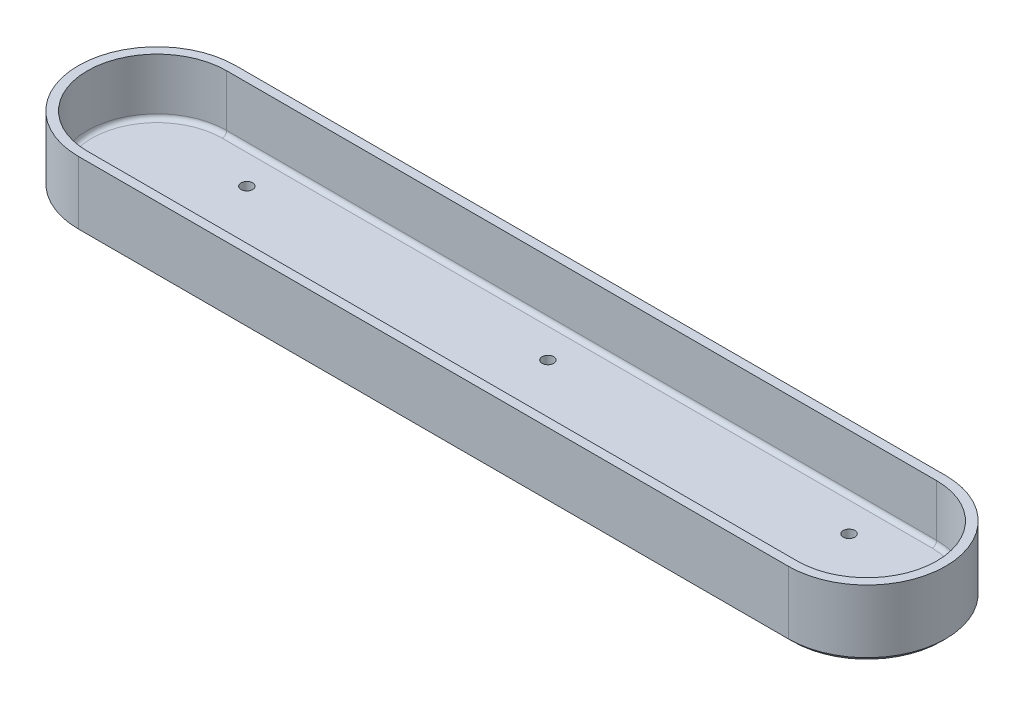
from build123d import *

# Parameters (mm, degrees)
MAINBLOCK_DEPTH     = 3.175
BOSS_EXTRUDE1_DEPTH = 19.05
SKETCH3_R           = 1.651
MOUNT_HOLES_DEPTH   = 127.00230613
FILLET1_R           = 1.27
CHAMFER1_SIZE       = 1.27


with BuildPart() as part:
    # Sketch1 → MainBlock (new body)
    with BuildSketch(Plane(origin=(0, 0, 0), x_dir=(1, 0, 0), z_dir=(0, 1, 0))):
        with BuildLine():
            Line((-100.33, 19.685), (100.33, 19.685))
            ThreePointArc((100.33, 19.685), (120.015, 0), (100.33, -19.685))
            Line((100.33, -19.685), (-100.33, -19.685))
            ThreePointArc((-100.33, -19.685), (-120.015, 0), (-100.33, 19.685))
        make_face()
    extrude(amount=MAINBLOCK_DEPTH)

    # Sketch2 → Boss-Extrude1 (add)
    with BuildSketch(Plane.XZ):
        with BuildLine():
            Line((-100.33, 22.225), (100.33, 22.225))
            ThreePointArc((100.33, 22.225), (122.555, 0), (100.33, -22.225))
            Line((100.33, -22.225), (-100.33, -22.225))
            ThreePointArc((-100.33, -22.225), (-122.555, 0), (-100.33, 22.225))
        make_face()
        with BuildLine():
            Line((100.33, 19.685), (-100.33, 19.685))
            ThreePointArc((-100.33, 19.685), (-120.015, 0), (-100.33, -19.685))
            Line((-100.33, -19.685), (100.33, -19.685))
            ThreePointArc((100.33, -19.685), (120.015, 0), (100.33, 19.685))
        make_face(mode=Mode.SUBTRACT)
    extrude(amount=-BOSS_EXTRUDE1_DEPTH)

    # Sketch3 → Mount-Holes (cut, through all)
    with BuildSketch(Plane.XZ):
        with Locations(Location((0, 10.16, 0), (0, 0, 270))):
            Circle(SKETCH3_R)
        with Locations(Location((-85.09, 10.16, 0), (0, 0, 270))):
            Circle(SKETCH3_R)
        with Locations(Location((85.09, 10.16, 0), (0, 0, 270))):
            Circle(SKETCH3_R)
        with Locations(Location((85.09, -10.16, 0), (0, 0, 270))):
            Circle(SKETCH3_R)
        with Locations(Location((-85.09, -10.16, 0), (0, 0, 270))):
            Circle(SKETCH3_R)
        with Locations(Location((0, -10.16, 0), (0, 0, 270))):
            Circle(SKETCH3_R)
    extrude(amount=-MOUNT_HOLES_DEPTH, mode=Mode.SUBTRACT)

    # Fillet1
    fillet1_edges = [part.edges().sort_by_distance(p)[0] for p in [
        (120.015, 3.175, 0),
        (0, 3.175, -19.685),
        (-120.015, 3.175, 0),
        (0, 3.175, 19.685),
    ]]
    fillet(fillet1_edges, radius=FILLET1_R)

    # Chamfer1
    chamfer1_edges = [part.edges().sort_by_distance(p)[0] for p in [
        (-122.555, 0, 0),
        (0, 0, -22.225),
        (122.555, 0, 0),
        (0, 0, 22.225),
    ]]
    chamfer(chamfer1_edges, length=CHAMFER1_SIZE)


solid = part.part
